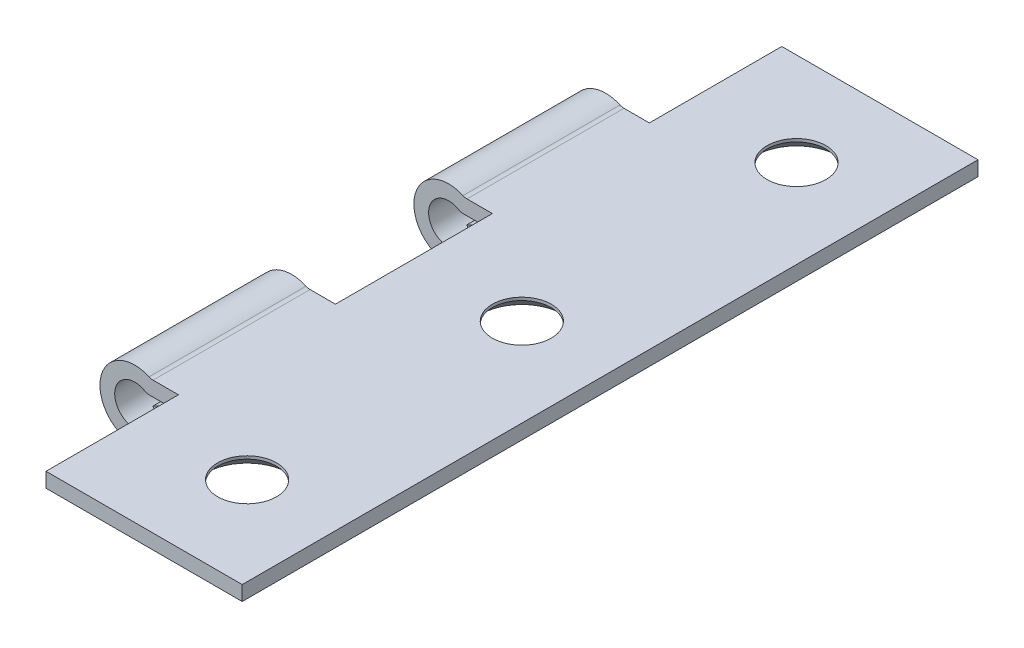
from build123d import *

# Parameters (mm, degrees)
BOSS_EXTRUDE1_DEPTH     = 37.5
CUT_EXTRUDE1_DEPTH      = 46.067643604
CUT_EXTRUDE1_DEPTH_BACK = 46.067643604
SKETCH2_W               = 8
SKETCH2_H               = 16
CUT_EXTRUDE2_DEPTH      = 46.067643604
CUT_EXTRUDE2_DEPTH_BACK = 46.067643604
SKETCH3_W               = 8
SKETCH3_H               = 13.5
SKETCH4_R               = 3
CUT_EXTRUDE3_DEPTH      = 46.067643604
LPATTERN1_COUNT         = 2
LPATTERN1_PITCH         = 28
MIRROR1_COPY_1_SKETCH_R = 3
MIRROR1_COPY_1_DEPTH    = 46.067643604
MIRROR1_COPY_2_SKETCH_R = 3
MIRROR1_COPY_2_DEPTH    = 46.067643604
CHAMFER1_SIZE           = 1.2


with BuildPart() as part:
    # Sketch1 → Boss-Extrude1 (new, symmetric)
    with BuildSketch(Plane.XY):
        with BuildLine():
            Line((1.865475811, 3.15), (24.45, 3.15))
            Line((24.45, 3.15), (24.45, 1.65))
            Line((24.45, 1.65), (1.509966887, 1.65))
            ThreePointArc((1.509966887, 1.65), (1.253893127, 1.683342755), (1.014895777, 1.781147541))
            ThreePointArc((1.014895777, 1.781147541), (-1.507477704, -1.389248347), (1.857930963, 0.866367437))
            Line((1.857930963, 0.866367437), (3.217392644, 1.500294829))
            ThreePointArc((3.217392644, 1.500294829), (-2.492742617, -2.527594557), (1.455481127, 3.237912088))
            ThreePointArc((1.455481127, 3.237912088), (1.655818843, 3.172224997), (1.865475811, 3.15))
        make_face()
    extrude(amount=BOSS_EXTRUDE1_DEPTH, both=True)

    # Sketch2 → Cut-Extrude1 (cut, two sides: drawn at the far end of the back side and taken through both)
    with BuildSketch(Plane.XZ.offset(-1.65).offset(-CUT_EXTRUDE1_DEPTH_BACK)):
        with Locations((0.45, 0)):
            Rectangle(SKETCH2_W, SKETCH2_H)
    extrude(amount=CUT_EXTRUDE1_DEPTH + CUT_EXTRUDE1_DEPTH_BACK, mode=Mode.SUBTRACT)

    # Sketch3 → Cut-Extrude2 (cut, two sides: drawn at the far end of the back side and taken through both)
    with BuildSketch(Plane.XZ.offset(-1.65).offset(-CUT_EXTRUDE2_DEPTH_BACK)):
        with Locations((0.45, 30.75)):
            Rectangle(SKETCH3_W, SKETCH3_H)
        with Locations((0.45, -30.75)):
            Rectangle(SKETCH3_W, SKETCH3_H)
    extrude(amount=CUT_EXTRUDE2_DEPTH + CUT_EXTRUDE2_DEPTH_BACK, mode=Mode.SUBTRACT)

    # Sketch4 → Cut-Extrude3 (cut, through all)
    with BuildSketch(Plane.XZ.offset(-1.65)):
        with Locations(Location((15.45, 0, 0), (0, 0, 270))):
            Circle(SKETCH4_R)
    cut_extrude3 = extrude(amount=-CUT_EXTRUDE3_DEPTH, mode=Mode.SUBTRACT)

    # LPattern1: Cut-Extrude3 ×2
    with Locations(*[(0, 0, -i * LPATTERN1_PITCH) for i in range(1, LPATTERN1_COUNT)]):
        add(cut_extrude3, mode=Mode.SUBTRACT)

    # Mirror1 copy 1 sketch → Mirror1 copy 1 (cut, through all)
    with BuildSketch(Plane(origin=(0, 1.65, 28), x_dir=(1, 0, 0), z_dir=(0, -1, 0))):
        with Locations((15.45, 0)):
            Circle(MIRROR1_COPY_1_SKETCH_R)
    extrude(amount=-MIRROR1_COPY_1_DEPTH, mode=Mode.SUBTRACT)

    # Mirror1 copy 2 sketch → Mirror1 copy 2 (cut, through all)
    with BuildSketch(Plane.XZ.offset(-1.65)):
        with Locations((15.45, 0)):
            Circle(MIRROR1_COPY_2_SKETCH_R)
    extrude(amount=-MIRROR1_COPY_2_DEPTH, mode=Mode.SUBTRACT)

    # Chamfer1
    chamfer1_edges = [part.edges().sort_by_distance(p)[0] for p in [
        (15.45, 1.65, 3),
        (15.45, 1.65, -25),
        (12.45, 1.65, 28),
    ]]
    chamfer(chamfer1_edges, length=CHAMFER1_SIZE)


solid = part.part
